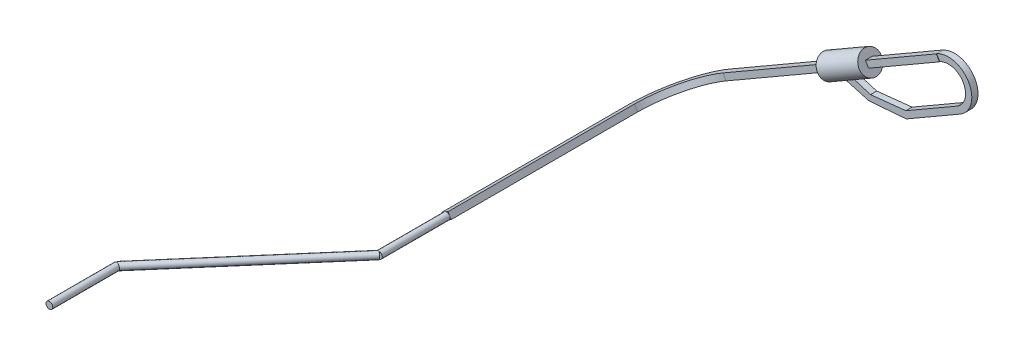
from build123d import *

# Parameters (mm, degrees)
S01_TENDON_CAPTIVE_TAIL_R                      = 0.6
F_01_TENDON_CAPTIVE_TAIL_DEPTH                 = 12
S02_CROSSED_TENDON_R                           = 0.6
F_02_CROSSED_TENDON_DEPTH                      = 33.010681761
S03_TENDON_THROUGH_REAR_GROMMET_R              = 0.6
F_03_TENDON_THROUGH_REAR_GROMMET_DEPTH         = 12
F_04_START                                     = -0.55
F_04_TENDON_RETURN_DEPTH                       = 1.1
F_05_START                                     = -0.55
F_05_REMOVABLE_BACKED_EYE_AROUND_POLISHE_DEPTH = 1.1
S06_DRESSED_EYE_KNOT_ENVELOPE_R                = 2
F_06_DRESSED_EYE_KNOT_ENVELOPE_DEPTH           = 8.5


with BuildPart() as part:
    # S01 - Tendon captive tail → 01 - Tendon captive tail (new body)
    with BuildSketch(Plane.XY.offset(25.959868809)):
        with Locations((5.619098901, -13.907757819)):
            Circle(S01_TENDON_CAPTIVE_TAIL_R)
    extrude(amount=F_01_TENDON_CAPTIVE_TAIL_DEPTH)

    # S02 - Crossed tendon → 02 - Crossed tendon (add)
    with BuildSketch(Plane(origin=(10.190970454, -0.54666496, -12.992860813), x_dir=(0.7871038979441459, 0.025929320968004606, 0.6162752016390648), z_dir=(-0.6168204388970357, 0.0330875378277926, 0.7864081389452698))):
        with Locations(Location((20.060619317, -14.986740778, 0), (0, 0, 266.097812634))):
            Circle(S02_CROSSED_TENDON_R)
    extrude(amount=F_02_CROSSED_TENDON_DEPTH)

    # S03 - Tendon through rear grommet → 03 - Tendon through rear grommet (add)
    with BuildSketch(Plane.XY.offset(-12)):
        with Locations(Location((25.980762114, -15, 0), (0, 0, 266.929477468))):
            Circle(S03_TENDON_THROUGH_REAR_GROMMET_R)
    extrude(amount=F_03_TENDON_THROUGH_REAR_GROMMET_DEPTH)

    # S04 - Tendon return → 04 - Tendon return (add)
    with BuildSketch(Plane(origin=(12.990381057, -22.5, 0), x_dir=(-0.8660254037844386, -0.5000000000000003, 0), z_dir=(0.5000000000000003, -0.8660254037844386, 0)).offset(F_04_START)):
        with BuildLine():
            Line((-14.4, 12), (-14.4, 45))
            ThreePointArc((-14.4, 45), (-17.211774901, 51.788225099), (-24, 54.6))
            Line((-24, 54.6), (-67.598500564, 54.6))
            Line((-67.598500564, 54.6), (-67.598500564, 53.4))
            Line((-67.598500564, 53.4), (-24, 53.4))
            ThreePointArc((-24, 53.4), (-18.060303038, 50.939696962), (-15.6, 45))
            Line((-15.6, 45), (-15.6, 12))
            Line((-15.6, 12), (-14.4, 12))
        make_face()
    extrude(amount=F_04_TENDON_RETURN_DEPTH)

    # S05 - Removable backed eye around polished clevis sleeve → 05 - Removable backed eye around polished clevis sleeve (add)
    with BuildSketch(Plane.XY.offset(-54).offset(F_05_START)):
        with BuildLine():
            Line((71.084194722, 11.675564254), (71.257399803, 11.775564254))
            ThreePointArc((71.257399803, 11.775564254), (76.926405229, 10.256558829), (75.407399803, 4.587553403))
            Line((75.407399803, 4.587553403), (65.881120362, -0.912446597))
            Line((65.881120362, -0.912446597), (59.259967939, -1.444274196))
            Line((59.259967939, -1.444274196), (53.745866324, 0.106429959))
            Line((53.745866324, 0.106429959), (54.211891727, 1.299250282))
            Line((54.211891727, 1.299250282), (59.552788262, -0.351453873))
            Line((59.552788262, -0.351453873), (65.807434334, 0.315181347))
            Line((65.807434334, 0.315181347), (74.857399803, 5.540181347))
            ThreePointArc((74.857399803, 5.540181347), (75.973777285, 9.706558829), (71.807399803, 10.82293631))
            Line((71.807399803, 10.82293631), (71.634194722, 10.72293631))
            Line((71.634194722, 10.72293631), (71.084194722, 11.675564254))
        make_face()
    extrude(amount=F_05_REMOVABLE_BACKED_EYE_AROUND_POLISHE_DEPTH)

    # S06 - Dressed eye knot envelope → 06 - Dressed eye knot envelope (add)
    with BuildSketch(Plane(origin=(38.623434459, 22.299250282, 0), x_dir=(0, 0, -1), z_dir=(0.8660254037844386, 0.5000000000000003, 0))):
        with Locations(Location((54, -25.980762114, 0), (0, 0, 90))):
            Circle(S06_DRESSED_EYE_KNOT_ENVELOPE_R)
    extrude(amount=F_06_DRESSED_EYE_KNOT_ENVELOPE_DEPTH)


solid = part.part
